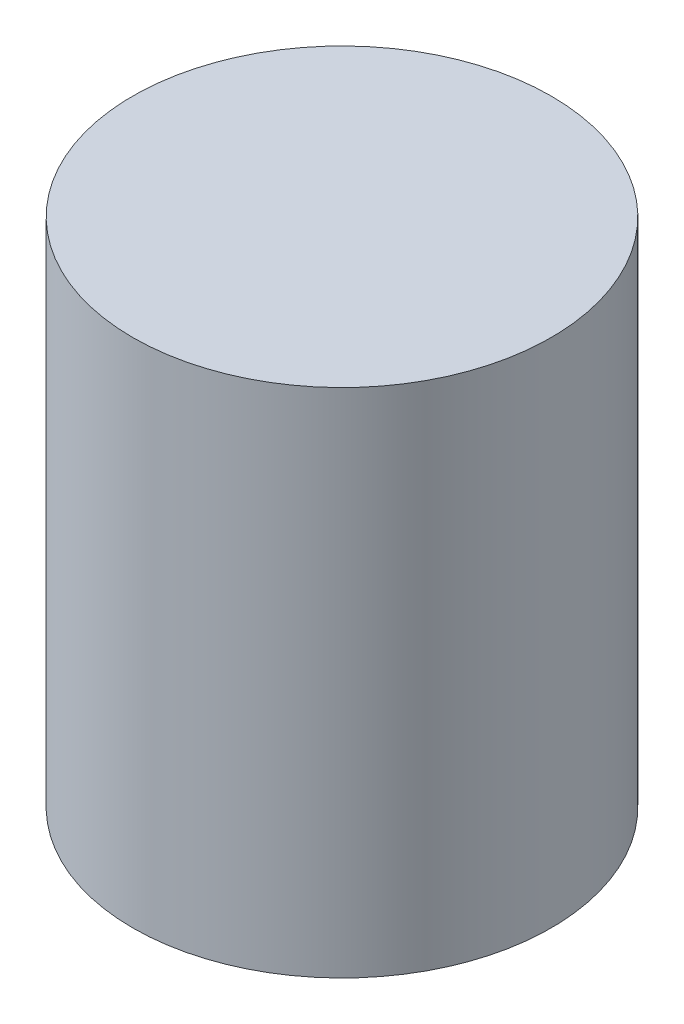
from build123d import *

# Parameters (mm, degrees)
SKETCH1_R           = 13.5
BOSS_EXTRUDE1_DEPTH = 33


with BuildPart() as part:
    # Sketch1 → Boss-Extrude1 (new body)
    with BuildSketch(Plane(origin=(0, 0, 0), x_dir=(1, 0, 0), z_dir=(0, 1, 0))):
        with Locations(Location((0, 0, 0), (0, 0, 270))):
            Circle(SKETCH1_R)
    extrude(amount=BOSS_EXTRUDE1_DEPTH)


solid = part.part
